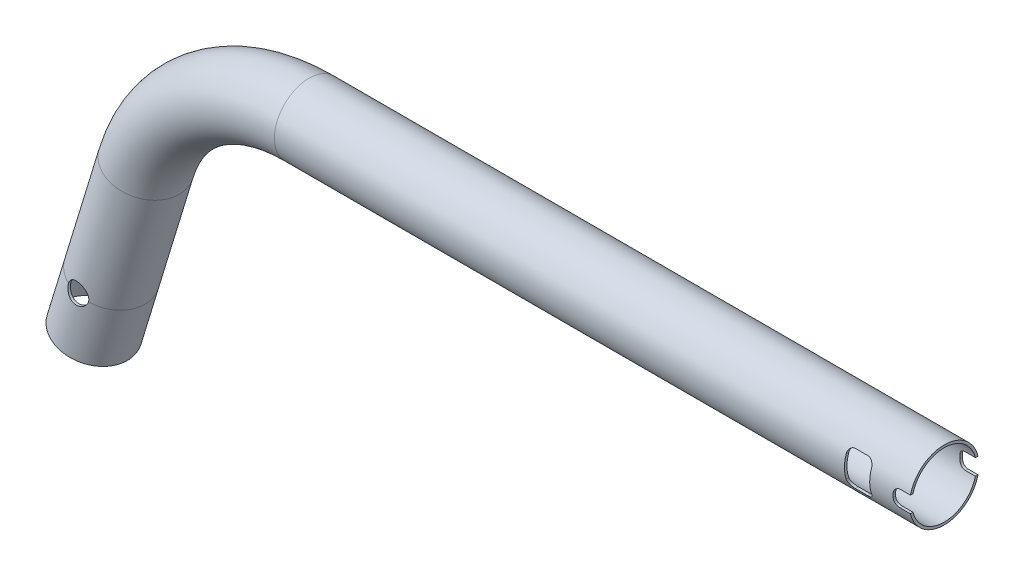
from build123d import *

# Parameters (mm, degrees)
SKETCH3_R          = 11
SKETCH3_R_2        = 10.2
CUT_EXTRUDE1_REACH = 197.895
SKETCH4_R          = 3.3
SKETCH5_R          = 3.3
CUT_EXTRUDE2_DEPTH = 196.894862351
CUT_EXTRUDE3_DEPTH = 196.894862351


with BuildPart() as part:
    # Sweep2: sweep along a path in Sketch1
    with BuildLine(Plane.XY) as sweep2_path:
        Line((108.839588828, 0), (92.239588828, 0))
        Line((92.239588828, 0), (-92.239588828, 0))
        ThreePointArc((-92.239588828, 0), (-124.360019313, -10.591729527), (-143.88004565, -38.211927945))
        Line((-143.88004565, -38.211927945), (-154.760411172, -73.8))
        Line((-154.760411172, -73.8), (-160.324709574, -92))
    # Sketch3 → Sweep2 (sweep)
    with BuildSketch(Plane(origin=(92.239588828, 0, 0), x_dir=(0, 0, -1), z_dir=(1, 0, 0))):
        Circle(SKETCH3_R)
        Circle(SKETCH3_R_2, mode=Mode.SUBTRACT)
    sweep(path=sweep2_path.line)

    # Sketch4 → Cut-Extrude1 (cut, up to next)
    with BuildSketch(Plane.XY, mode=Mode.PRIVATE) as cut_extrude1_sk1:
        with Locations((-154.760411172, -73.8)):
            Circle(SKETCH4_R)
    cut_extrude1_tool1 = extrude(cut_extrude1_sk1.sketch, amount=CUT_EXTRUDE1_REACH, mode=Mode.PRIVATE) & part.part
    # Sketch4 → Cut-Extrude1 (cut, up to next)
    with BuildSketch(Plane.XY, mode=Mode.PRIVATE) as cut_extrude1_sk2:
        with BuildLine():
            Line((108.839588828, 2.555545653), (108.839588828, -2.555545653))
            Line((108.839588828, -2.555545653), (105.639588828, -2.555545653))
            ThreePointArc((105.639588828, -2.555545653), (104.225375266, -1.969759216), (103.639588828, -0.555545653))
            Line((103.639588828, -0.555545653), (103.639588828, 0.555545653))
            ThreePointArc((103.639588828, 0.555545653), (104.225375266, 1.969759216), (105.639588828, 2.555545653))
            Line((105.639588828, 2.555545653), (108.839588828, 2.555545653))
        make_face()
    cut_extrude1_tool2 = extrude(cut_extrude1_sk2.sketch, amount=CUT_EXTRUDE1_REACH, mode=Mode.PRIVATE) & part.part
    # Sketch4 → Cut-Extrude1 (cut, up to next)
    with BuildSketch(Plane.XY, mode=Mode.PRIVATE) as cut_extrude1_sk3:
        with BuildLine():
            Line((90.239588828, -5.5), (94.239588828, -5.5))
            ThreePointArc((94.239588828, -5.5), (95.653802391, -4.914213562), (96.239588828, -3.5))
            Line((96.239588828, -3.5), (96.239588828, 3.5))
            ThreePointArc((96.239588828, 3.5), (95.653802391, 4.914213562), (94.239588828, 5.5))
            Line((94.239588828, 5.5), (90.239588828, 5.5))
            ThreePointArc((90.239588828, 5.5), (88.825375266, 4.914213562), (88.239588828, 3.5))
            Line((88.239588828, 3.5), (88.239588828, -3.5))
            ThreePointArc((88.239588828, -3.5), (88.825375266, -4.914213562), (90.239588828, -5.5))
        make_face()
    cut_extrude1_tool3 = extrude(cut_extrude1_sk3.sketch, amount=CUT_EXTRUDE1_REACH, mode=Mode.PRIVATE) & part.part
    add(cut_extrude1_tool1.solids().sort_by_distance((-154.760411, -73.8, 0))[0], mode=Mode.SUBTRACT)
    add(cut_extrude1_tool2.solids().sort_by_distance((106.388287, 0, 0))[0], mode=Mode.SUBTRACT)
    add(cut_extrude1_tool3.solids().sort_by_distance((92.239589, 0, 0))[0], mode=Mode.SUBTRACT)

    # Sketch5 → Cut-Extrude2 (cut, through all)
    with BuildSketch(Plane.XY):
        with Locations((-154.760411172, -73.8)):
            Circle(SKETCH5_R)
    extrude(amount=-CUT_EXTRUDE2_DEPTH, mode=Mode.SUBTRACT)

    # Sketch6 → Cut-Extrude3 (cut, through all)
    with BuildSketch(Plane.XY):
        with BuildLine():
            Line((108.839588828, 2.555545653), (105.639588828, 2.555545653))
            ThreePointArc((105.639588828, 2.555545653), (104.225375266, 1.969759216), (103.639588828, 0.555545653))
            Line((103.639588828, 0.555545653), (103.639588828, -0.555545653))
            ThreePointArc((103.639588828, -0.555545653), (104.225375266, -1.969759216), (105.639588828, -2.555545653))
            Line((105.639588828, -2.555545653), (108.839588828, -2.555545653))
            Line((108.839588828, -2.555545653), (108.839588828, 2.555545653))
        make_face()
    extrude(amount=-CUT_EXTRUDE3_DEPTH, mode=Mode.SUBTRACT)


solid = part.part
